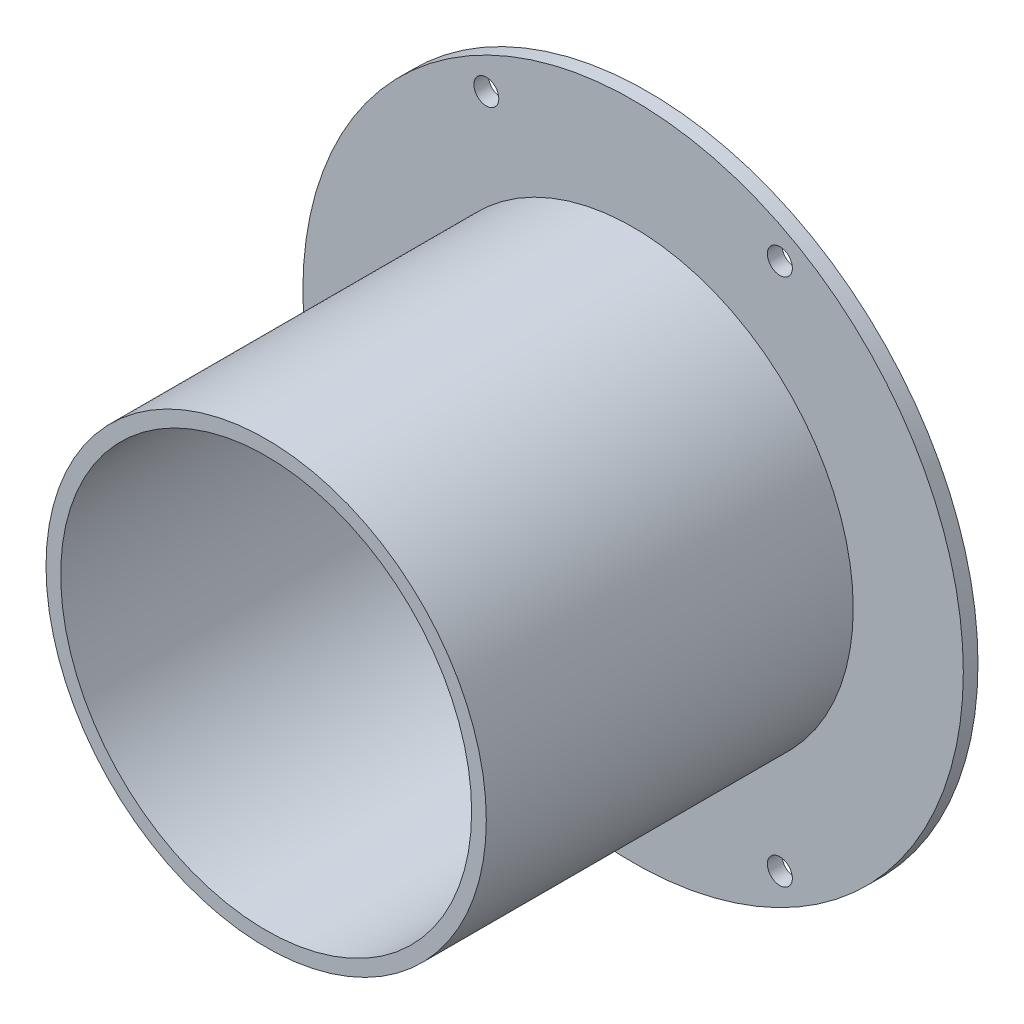
from build123d import *

# Parameters (mm, degrees)
SKETCH1_R                        = 45
SKETCH1_R_2                      = 7
GUARD_FLANGE_DEPTH               = 2
COUPLING_CONTACT_COVER_START     = 2
SKETCH2_R                        = 30
SKETCH2_R_2                      = 28
COUPLING_CONTACT_COVER_DEPTH     = 50
SKETCH3_R                        = 1.7
FOUR_M3_GUARD_FIXING_HOLES_DEPTH = 2.01


with BuildPart() as part:
    # Sketch1 → Guard_Flange (new body)
    with BuildSketch(Plane.XY):
        Circle(SKETCH1_R)
        Circle(SKETCH1_R_2, mode=Mode.SUBTRACT)
    extrude(amount=GUARD_FLANGE_DEPTH)

    # Sketch2 → Coupling_Contact_Cover (add)
    with BuildSketch(Plane.XY.offset(COUPLING_CONTACT_COVER_START)):
        Circle(SKETCH2_R)
        Circle(SKETCH2_R_2, mode=Mode.SUBTRACT)
    extrude(amount=COUPLING_CONTACT_COVER_DEPTH)

    # Sketch3 → Four_M3_Guard_Fixing_Holes (cut)
    with BuildSketch(Plane(origin=(0, 0, 0), x_dir=(-1, 0, 0), z_dir=(0, 0, -1))):
        with Locations((20, -36)):
            Circle(SKETCH3_R)
        with Locations((20, 36)):
            Circle(SKETCH3_R)
        with Locations((-20, -36)):
            Circle(SKETCH3_R)
        with Locations((-20, 36)):
            Circle(SKETCH3_R)
    extrude(amount=-FOUR_M3_GUARD_FIXING_HOLES_DEPTH, mode=Mode.SUBTRACT)


solid = part.part
